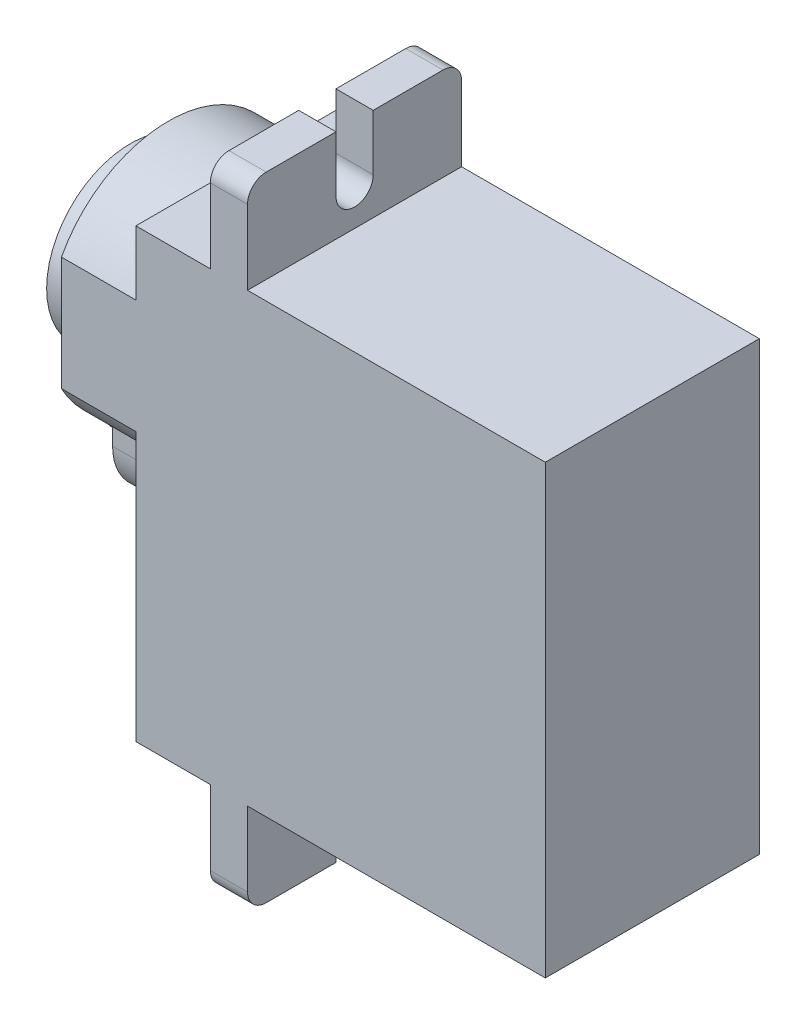
from build123d import *

# Parameters (mm, degrees)
BOSS_EXTRU_2_DEPTH           = 13.8
ENL_V_MAT_EXTRU_1_DEPTH      = 33.759120867
ENL_V_MAT_EXTRU_1_DEPTH_BACK = 13.8
CONG_1_R                     = 1.2
ENL_V_MAT_EXTRU_4_DEPTH      = 33.759120867
ENL_V_MAT_EXTRU_4_DEPTH_BACK = 13.8
CONG_2_R                     = 1.2
BOSS_EXTRU_4_DEPTH           = 4.8
BOSS_EXTRU_5_DEPTH           = 2.4
ESQUISSE8_R                  = 3
ENL_V_MAT_EXTRU_5_DEPTH      = 12


with BuildPart() as part:
    # Esquisse1 → Boss.-Extru.2 (new body)
    with BuildSketch(Plane.XY):
        Polygon((-8.4, 14.4), (-13.2, 14.4), (-13.2, -14.4), (-8.4, -14.4), (-8.4, -20.4), (-6, -20.4), (-6, -14.4), (13.2, -14.4), (13.2, 14.4), (-6, 14.4), (-6, 20.4), (-8.4, 20.4), align=None)
    extrude(amount=BOSS_EXTRU_2_DEPTH)

    # Esquisse3 → Enlèv. mat.-Extru.1 (cut, two sides: drawn at the far end of the back side and taken through both)
    with BuildSketch(Plane.ZY.offset(8.4).offset(-ENL_V_MAT_EXTRU_1_DEPTH_BACK)):
        with BuildLine():
            Line((5.7, 113.592547743), (5.7, 20.4))
            Line((5.7, 20.4), (5.7, 16.8))
            ThreePointArc((5.7, 16.8), (6.9, 15.6), (8.1, 16.8))
            Line((8.1, 16.8), (8.1, 20.4))
            Line((8.1, 20.4), (8.1, 113.592547743))
            Line((8.1, 113.592547743), (8.1, 299.97764323))
            Line((8.1, 299.97764323), (5.7, 299.97764323))
            Line((5.7, 299.97764323), (5.7, 113.592547743))
        make_face()
    extrude(amount=ENL_V_MAT_EXTRU_1_DEPTH + ENL_V_MAT_EXTRU_1_DEPTH_BACK, mode=Mode.SUBTRACT)

    # Congé1
    cong_1_edges = [part.edges().sort_by_distance(p)[0] for p in [
        (-7.2, 20.4, 0),
        (-7.2, 20.4, 13.8),
    ]]
    fillet(cong_1_edges, radius=CONG_1_R)

    # Esquisse5 → Enlèv. mat.-Extru.4 (cut, two sides: drawn at the far end of the back side and taken through both)
    with BuildSketch(Plane.ZY.offset(8.4).offset(-ENL_V_MAT_EXTRU_4_DEPTH_BACK)):
        with BuildLine():
            Line((5.7, -16.8), (5.7, -20.4))
            Line((5.7, -20.4), (8.1, -20.4))
            Line((8.1, -20.4), (8.1, -16.8))
            ThreePointArc((8.1, -16.8), (6.9, -15.6), (5.7, -16.8))
        make_face()
    extrude(amount=ENL_V_MAT_EXTRU_4_DEPTH + ENL_V_MAT_EXTRU_4_DEPTH_BACK, mode=Mode.SUBTRACT)

    # Congé2
    cong_2_edges = [part.edges().sort_by_distance(p)[0] for p in [
        (-7.2, -20.4, 0),
        (-7.2, -20.4, 13.8),
    ]]
    fillet(cong_2_edges, radius=CONG_2_R)

    # Esquisse6 → Boss.-Extru.4 (add)
    with BuildSketch(Plane.ZY.offset(13.2)):
        with BuildLine():
            Line((3.3, -1.960815773), (3.3, -0.355303277))
            ThreePointArc((3.3, -0.355303277), (1.40200229, 1.026689827), (0, 2.909955561))
            Line((0, 2.909955561), (0, 10.256412893))
            ThreePointArc((0, 10.256412893), (6.9, 14.4), (13.8, 10.256412893))
            Line((13.8, 10.256412893), (13.8, 2.909955561))
            ThreePointArc((13.8, 2.909955561), (12.39799771, 1.026689827), (10.5, -0.355303277))
            Line((10.5, -0.355303277), (10.5, -1.960815773))
            ThreePointArc((10.5, -1.960815773), (6.9, -5.560815773), (3.3, -1.960815773))
        make_face()
    extrude(amount=BOSS_EXTRU_4_DEPTH)

    # Esquisse7 → Boss.-Extru.5 (add)
    with BuildSketch(Plane.ZY.offset(18)):
        with BuildLine():
            Line((5.1, -1.960815773), (5.1, 1.500148416))
            ThreePointArc((5.1, 1.500148416), (7.011460398, 11.971564485), (8.7, 1.461898964))
            Line((8.7, 1.461898964), (8.7, -1.960815773))
            ThreePointArc((8.7, -1.960815773), (6.9, -3.760815773), (5.1, -1.960815773))
        make_face()
    extrude(amount=BOSS_EXTRU_5_DEPTH)

    # Esquisse8 → Enlèv. mat.-Extru.5 (cut)
    with BuildSketch(Plane.ZY.offset(20.4)):
        with Locations((6.954089459, 6.571869256)):
            Circle(ESQUISSE8_R)
    extrude(amount=-ENL_V_MAT_EXTRU_5_DEPTH, mode=Mode.SUBTRACT)


solid = part.part
